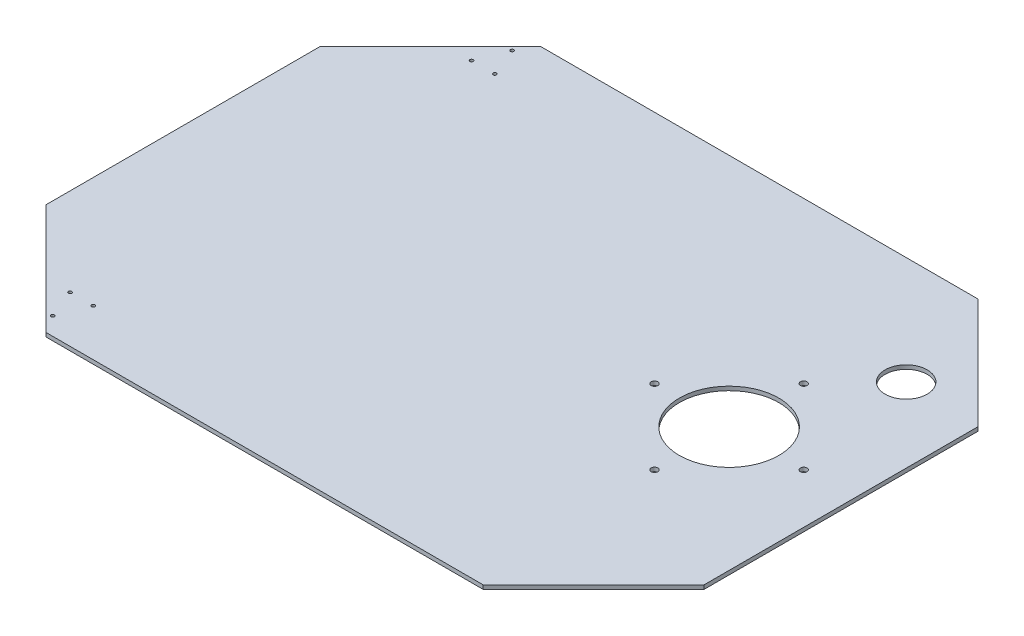
from build123d import *

# Parameters (mm, degrees)
SKETCH1_W           = 396.875
SKETCH1_H           = 298.45
BOSS_EXTRUDE1_DEPTH = 2.38125
SKETCH5_R           = 1
CUT_EXTRUDE4_DEPTH  = 10
SKETCH6_R           = 2
SKETCH6_R_2         = 30
CUT_EXTRUDE5_DEPTH  = 10
SKETCH7_R           = 12.7
CUT_EXTRUDE6_DEPTH  = 10
CUT_EXTRUDE7_DEPTH  = 10


with BuildPart() as part:
    # Sketch1 → Boss-Extrude1 (new body)
    with BuildSketch(Plane(origin=(0, 0, 0), x_dir=(1, 0, 0), z_dir=(0, 1, 0))):
        Rectangle(SKETCH1_W, SKETCH1_H)
    extrude(amount=BOSS_EXTRUDE1_DEPTH)

    # Sketch5 → Cut-Extrude4 (cut)
    with BuildSketch(Plane.XZ):
        with Locations(Location((-138.4375, 138.55, 0), (0, 0, 270))):
            Circle(SKETCH5_R)
        with Locations(Location((-138.4375, -138.55, 0), (0, 0, 270))):
            Circle(SKETCH5_R)
        with Locations(Location((-131.4375, -121.05, 0), (0, 0, 270))):
            Circle(SKETCH5_R)
        with Locations(Location((-131.4375, 121.05, 0), (0, 0, 270))):
            Circle(SKETCH5_R)
        with Locations(Location((-145.4375, 121.05, 0), (0, 0, 270))):
            Circle(SKETCH5_R)
        with Locations(Location((-145.4375, -121.05, 0), (0, 0, 270))):
            Circle(SKETCH5_R)
    extrude(amount=-CUT_EXTRUDE4_DEPTH, mode=Mode.SUBTRACT)

    # Sketch6 → Cut-Extrude5 (cut)
    with BuildSketch(Plane(origin=(0, 2.38125, 0), x_dir=(1, 0, 0), z_dir=(0, 1, 0))):
        with Locations(Location((123.4375, 52.475, 0), (0, 0, 270))):
            Circle(SKETCH6_R)
        with Locations(Location((123.4375, -37.525, 0), (0, 0, 270))):
            Circle(SKETCH6_R)
        with Locations(Location((168.4375, 7.475, 0), (0, 0, 270))):
            Circle(SKETCH6_R)
        with Locations(Location((78.4375, 7.475, 0), (0, 0, 270))):
            Circle(SKETCH6_R)
        with Locations(Location((123.4375, 7.475, 0), (0, 0, 270))):
            Circle(SKETCH6_R_2)
    extrude(amount=-CUT_EXTRUDE5_DEPTH, mode=Mode.SUBTRACT)

    # Sketch7 → Cut-Extrude6 (cut)
    with BuildSketch(Plane(origin=(0, 2.38125, 0), x_dir=(1, 0, 0), z_dir=(0, 1, 0))):
        with Locations(Location((153.4375, 84.225, 0), (0, 0, 270))):
            Circle(SKETCH7_R)
    extrude(amount=-CUT_EXTRUDE6_DEPTH, mode=Mode.SUBTRACT)

    # Sketch8 → Cut-Extrude7 (cut)
    with BuildSketch(Plane(origin=(0, 2.38125, 0), x_dir=(1, 0, 0), z_dir=(0, 1, 0))):
        Polygon((131.7625, -149.225), (198.4375, -82.55), (198.4375, -149.225), align=None)
        Polygon((198.4375, 149.225), (131.7625, 149.225), (198.4375, 82.55), align=None)
    cut_extrude7 = extrude(amount=-CUT_EXTRUDE7_DEPTH, mode=Mode.SUBTRACT)

    # Mirror1: Cut-Extrude7 across plane
    add(cut_extrude7.mirror(Plane(origin=(0, 0, 0), x_dir=(0, 0, 1), z_dir=(1, 0, 0))), mode=Mode.SUBTRACT)


solid = part.part
